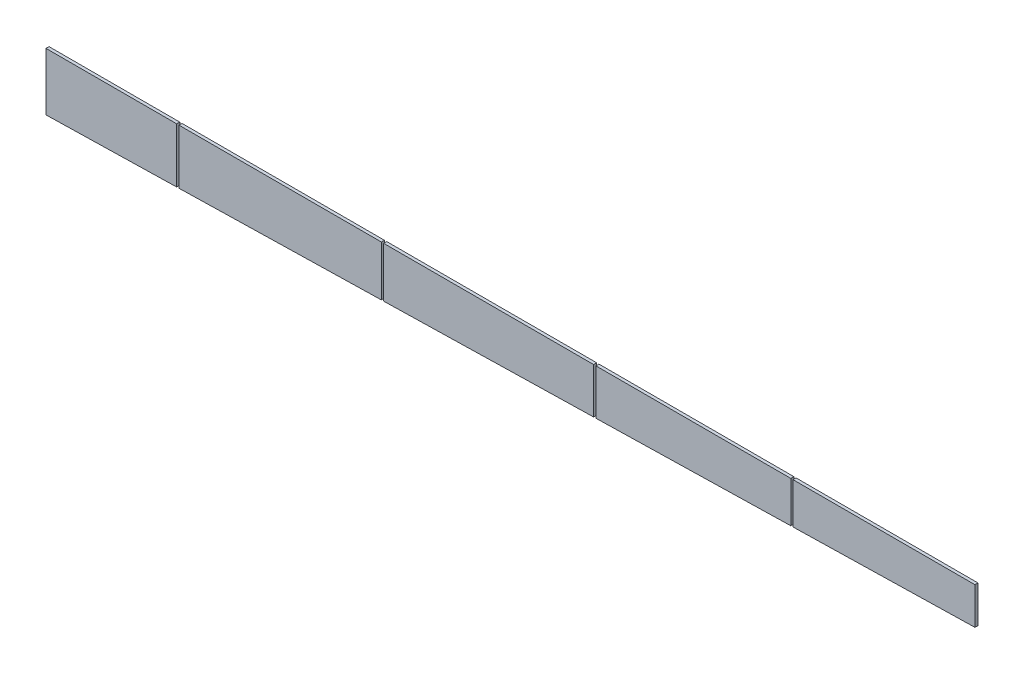
from build123d import *

# Parameters (mm, degrees)
EXTRUDE_1_DEPTH   = 2
EXTRUDE_1_2_DEPTH = 2
EXTRUDE_1_3_DEPTH = 2
EXTRUDE_1_4_DEPTH = 2
EXTRUDE_1_5_DEPTH = 2


with BuildPart() as part:
    # 草图1 → 凸台-拉伸1 (new body)
    with BuildSketch(Plane.XY):
        Polygon((9.042992345, 42.752160749), (9.042992345, 4.734107643), (95.268336964, 6.652285198), (95.268336964, 42.752161033), align=None)
    extrude(amount=EXTRUDE_1_DEPTH)


with BuildPart() as body_2:
    # 草图1 → Extrude 1 2 (new body)
    with BuildSketch(Plane.XY):
        Polygon((96.768336964, 42.752161038), (96.768336964, 6.685654347), (230.268336964, 9.655508567), (230.268336964, 42.752161477), align=None)
    extrude(amount=EXTRUDE_1_2_DEPTH)


with BuildPart() as body_3:
    # 草图1 → Extrude 1 3 (new body)
    with BuildSketch(Plane.XY):
        Polygon((231.768336964, 42.752161482), (370.268336964, 42.752161939), (370.268336964, 12.769962432), (231.768336964, 9.688877716), align=None)
    extrude(amount=EXTRUDE_1_3_DEPTH)


with BuildPart() as body_4:
    # 草图1 → Extrude 1 4 (new body)
    with BuildSketch(Plane.XY):
        Polygon((371.768336964, 42.752161943), (371.768336964, 12.80333158), (500.268336964, 15.661955306), (500.268336964, 42.752162367), align=None)
    extrude(amount=EXTRUDE_1_4_DEPTH)


with BuildPart() as body_5:
    # 草图1 → Extrude 1 5 (new body)
    with BuildSketch(Plane.XY):
        Polygon((501.768336964, 42.752162372), (501.768336964, 15.695324454), (621.768336633, 18.364856331), (621.76833689, 42.752162767), align=None)
    extrude(amount=EXTRUDE_1_5_DEPTH)


solid = Compound([part.part, body_2.part, body_3.part, body_4.part, body_5.part])
